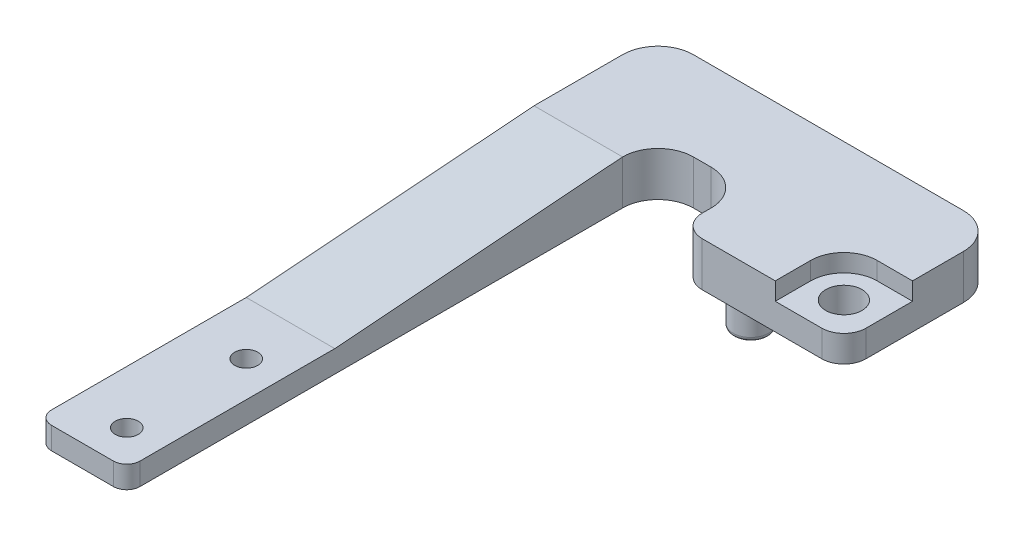
from build123d import *

# Parameters (mm, degrees)
SKETCH1_R                = 4.1
SKETCH1_R_2              = 4
SKETCH1_R_3              = 2.6
BOSS_EXTRUDE1_DEPTH      = 10
CUT_EXTRUDE1_START       = -4
CUT_EXTRUDE1_DEPTH       = 4
CUT_EXTRUDE2_REACH       = 113.917
BOSS_EXTRUDE2_DEPTH      = 10
BOSS_EXTRUDE2_DEPTH_BACK = 10
SKETCH5_R                = 4
FILLET1_R                = 1


with BuildPart() as part:
    # Sketch1 → Boss-Extrude1 (new body)
    with BuildSketch(Plane(origin=(0, 0, 0), x_dir=(1, 0, 0), z_dir=(0, 1, 0))):
        with BuildLine():
            Line((28.853428594, 9.206712552), (1.853428594, 9.206712552))
            ThreePointArc((1.853428594, 9.206712552), (-1.682105312, 10.671178646), (-3.146571406, 14.206712552))
            Line((-3.146571406, 14.206712552), (-3.146571406, 16.206712552))
            ThreePointArc((-3.146571406, 16.206712552), (-5.489717157, 21.863566801), (-11.146571406, 24.206712552))
            Line((-11.146571406, 24.206712552), (-15.146571406, 24.206712552))
            ThreePointArc((-15.146571406, 24.206712552), (-20.803425656, 21.863566801), (-23.146571406, 16.206712552))
            Line((-23.146571406, 16.206712552), (-23.146571406, -92.793287448))
            ThreePointArc((-23.146571406, -92.793287448), (-24.025251062, -94.914607792), (-26.146571406, -95.793287448))
            Line((-26.146571406, -95.793287448), (-40.146571406, -95.793287448))
            ThreePointArc((-40.146571406, -95.793287448), (-42.26789175, -94.914607792), (-43.146571406, -92.793287448))
            Line((-43.146571406, -92.793287448), (-43.146571406, 4.206712552))
            Line((-43.146571406, 4.206712552), (-43.146571406, 36.206712552))
            ThreePointArc((-43.146571406, 36.206712552), (-40.803425656, 41.863566801), (-35.146571406, 44.206712552))
            Line((-35.146571406, 44.206712552), (-3.146571406, 44.206712552))
            Line((-3.146571406, 44.206712552), (25.853428594, 44.206712552))
            ThreePointArc((25.853428594, 44.206712552), (31.510282843, 41.863566801), (33.853428594, 36.206712552))
            Line((33.853428594, 36.206712552), (33.853428594, 14.206712552))
            ThreePointArc((33.853428594, 14.206712552), (32.3889625, 10.671178646), (28.853428594, 9.206712552))
        make_face()
        with Locations(Location((25.853428594, 17.206712552, 0), (0, 0, 270))):
            Circle(SKETCH1_R, mode=Mode.SUBTRACT)
        with Locations(Location((4.853428594, 17.206712552, 0), (0, 0, 270))):
            Circle(SKETCH1_R_2, mode=Mode.SUBTRACT)
        with Locations(Location((-31.146571406, -87.793287448, 0), (0, 0, 270))):
            Circle(SKETCH1_R_3, mode=Mode.SUBTRACT)
        with Locations(Location((-31.146571406, -60.793287448, 0), (0, 0, 270))):
            Circle(SKETCH1_R_3, mode=Mode.SUBTRACT)
    extrude(amount=BOSS_EXTRUDE1_DEPTH)

    # Sketch2 → Cut-Extrude1 (cut)
    with BuildSketch(Plane(origin=(0, 10, 0), x_dir=(1, 0, 0), z_dir=(0, 1, 0)).offset(CUT_EXTRUDE1_START)):
        with BuildLine():
            Line((25.853428594, 24.706712552), (33.853428594, 24.706712552))
            Line((33.853428594, 24.706712552), (33.853428594, 14.206712552))
            ThreePointArc((33.853428594, 14.206712552), (32.3889625, 10.671178646), (28.853428594, 9.206712552))
            Line((28.853428594, 9.206712552), (18.353428594, 9.206712552))
            Line((18.353428594, 9.206712552), (18.353428594, 17.206712552))
            ThreePointArc((18.353428594, 17.206712552), (20.550127735, 22.510013411), (25.853428594, 24.706712552))
        make_face()
    extrude(amount=CUT_EXTRUDE1_DEPTH, mode=Mode.SUBTRACT)

    # Cut-Extrude2: up to this face of the body (flat: up to its plane)
    cut_extrude2_end = Plane(part.part.faces().sort_by_distance((-43.146571406, 5, 28.293287448))[0])
    # Sketch3 → Cut-Extrude2 (cut, up to the picked face)
    with BuildSketch(Plane(origin=(-23.146571406, 0, 0), x_dir=(0, 0, -1), z_dir=(1, 0, 0)), mode=Mode.PRIVATE) as cut_extrude2_sk1:
        Polygon((16.206712552, 10), (-48.793287448, 5), (-99.981688139, 5), (-99.981688139, 10), align=None)
    cut_extrude2_tool1 = split(extrude(cut_extrude2_sk1.sketch, amount=-CUT_EXTRUDE2_REACH, mode=Mode.PRIVATE), bisect_by=cut_extrude2_end, keep=Keep.BOTH, mode=Mode.PRIVATE)
    add(cut_extrude2_tool1.solids().sort_by(Axis((-23.146571, 7.823621, 56.033951), (-1, 0, 0)))[0], mode=Mode.SUBTRACT)

    # Sketch5 → Boss-Extrude2 (add, two sides: drawn at the far end of the back side and taken through both)
    with BuildSketch(Plane(origin=(0, 0, 0), x_dir=(-1, 0, 0), z_dir=(0, -1, 0)).offset(-BOSS_EXTRUDE2_DEPTH_BACK)):
        with Locations(Location((-4.853428594, 17.206712552, 0), (0, 0, 90))):
            Circle(SKETCH5_R)
    extrude(amount=BOSS_EXTRUDE2_DEPTH + BOSS_EXTRUDE2_DEPTH_BACK)

    # Fillet1
    fillet1_edges = [part.edges().sort_by_distance(p)[0] for p in [
        (4.853428594, 0, -13.206712552),
        (4.853428594, -10, -13.206712552),
    ]]
    fillet(fillet1_edges, radius=FILLET1_R)


solid = part.part
